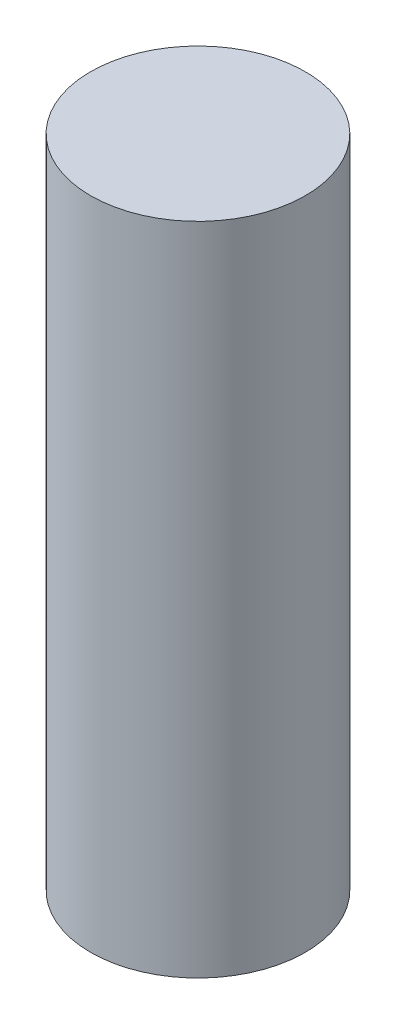
from build123d import *

# Parameters (mm, degrees)
ESQUISSE1_R        = 2.95
BOSS_EXTRU_1_DEPTH = 9


with BuildPart() as part:
    # Esquisse1 → Boss.-Extru.1 (new, symmetric)
    with BuildSketch(Plane(origin=(0, 0, 0), x_dir=(1, 0, 0), z_dir=(0, 1, 0))):
        with Locations(Location((0, 0, 0), (0, 0, 270))):
            Circle(ESQUISSE1_R)
    extrude(amount=BOSS_EXTRU_1_DEPTH, both=True)


solid = part.part
